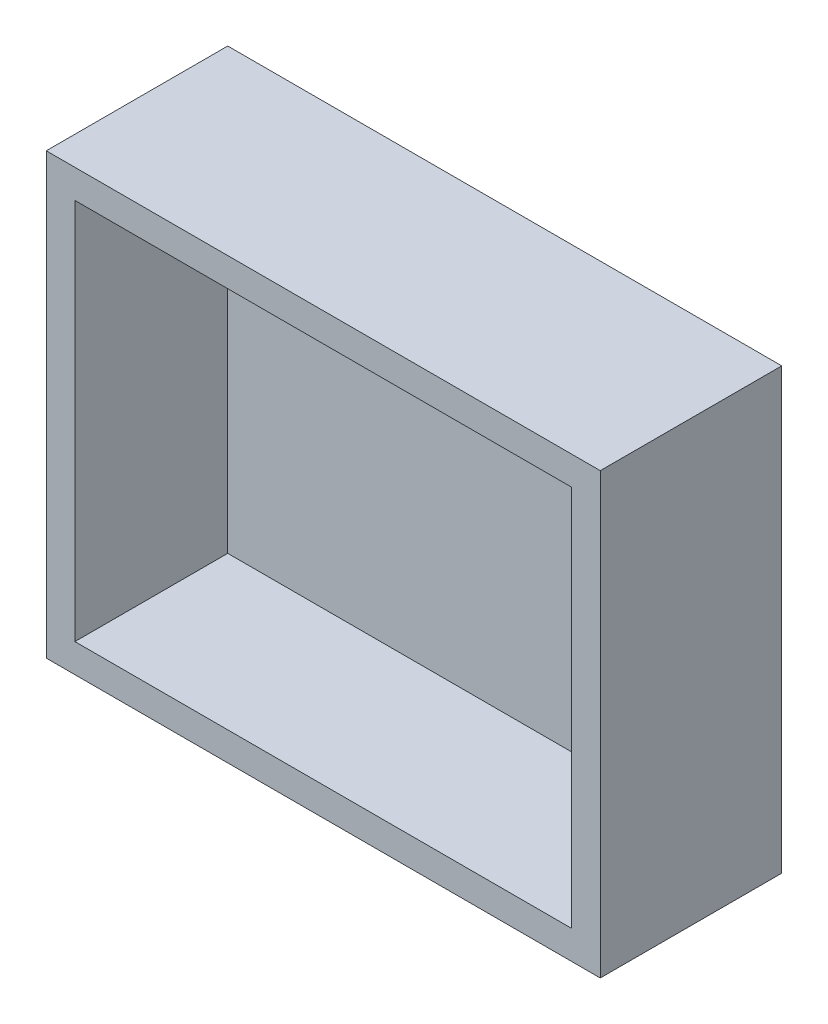
from build123d import *

# Parameters (mm, degrees)
SKETCH_1_W      = 290
SKETCH_1_H      = 230
SKETCH_1_W_2    = 260
SKETCH_1_H_2    = 200
EXTRUDE_1_DEPTH = 80
SKETCH_1_2_W    = 290
SKETCH_1_2_H    = 230
EXTRUDE_2_DEPTH = 15


with BuildPart() as part:
    # 草图1 → 凸台-拉伸1 (new body)
    with BuildSketch(Plane.XY):
        with Locations((145, 115)):
            Rectangle(SKETCH_1_W, SKETCH_1_H)
        with Locations((145, 115)):
            Rectangle(SKETCH_1_W_2, SKETCH_1_H_2, mode=Mode.SUBTRACT)
    extrude(amount=EXTRUDE_1_DEPTH)

    # 草图1<2> → 凸台-拉伸2 (add)
    with BuildSketch(Plane.XY):
        with Locations((145, 115)):
            Rectangle(SKETCH_1_2_W, SKETCH_1_2_H)
    extrude(amount=-EXTRUDE_2_DEPTH)


solid = part.part
